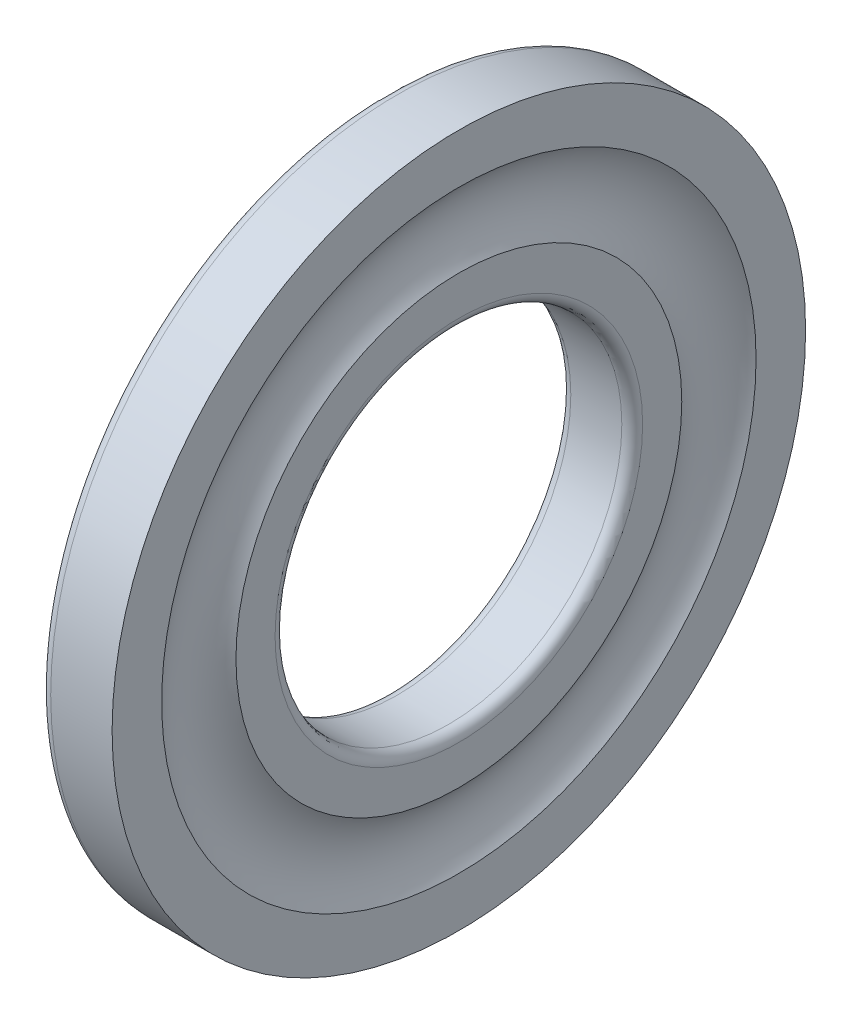
from build123d import *


with BuildPart() as part:
    # Croquis1 → Revolución1 (revolve)
    with BuildSketch(Plane.XY, mode=Mode.PRIVATE) as revoluci_n1_sk:
        with BuildLine():
            Line((0.6, 10), (3.542, 10))
            ThreePointArc((3.542, 10), (3.966264069, 10.175735931), (4.142, 10.6))
            Line((4.142, 10.6), (4.142, 12.857333437))
            ThreePointArc((4.142, 12.857333437), (3.428, 15), (4.142, 17.142666563))
            Line((4.142, 17.142666563), (4.142, 20))
            Line((4.142, 20), (0.6, 20))
            ThreePointArc((0.6, 20), (0.175735931, 19.824264069), (0, 19.4))
            Line((0, 19.4), (0, 10.6))
            ThreePointArc((0, 10.6), (0.175735931, 10.175735931), (0.6, 10))
        make_face()
    revolve(revoluci_n1_sk.sketch.rotate(Axis((3.542, 0, 0), (-1, 0, 0)), 90), axis=Axis((3.542, 0, 0), (-1, 0, 0)))


solid = part.part
